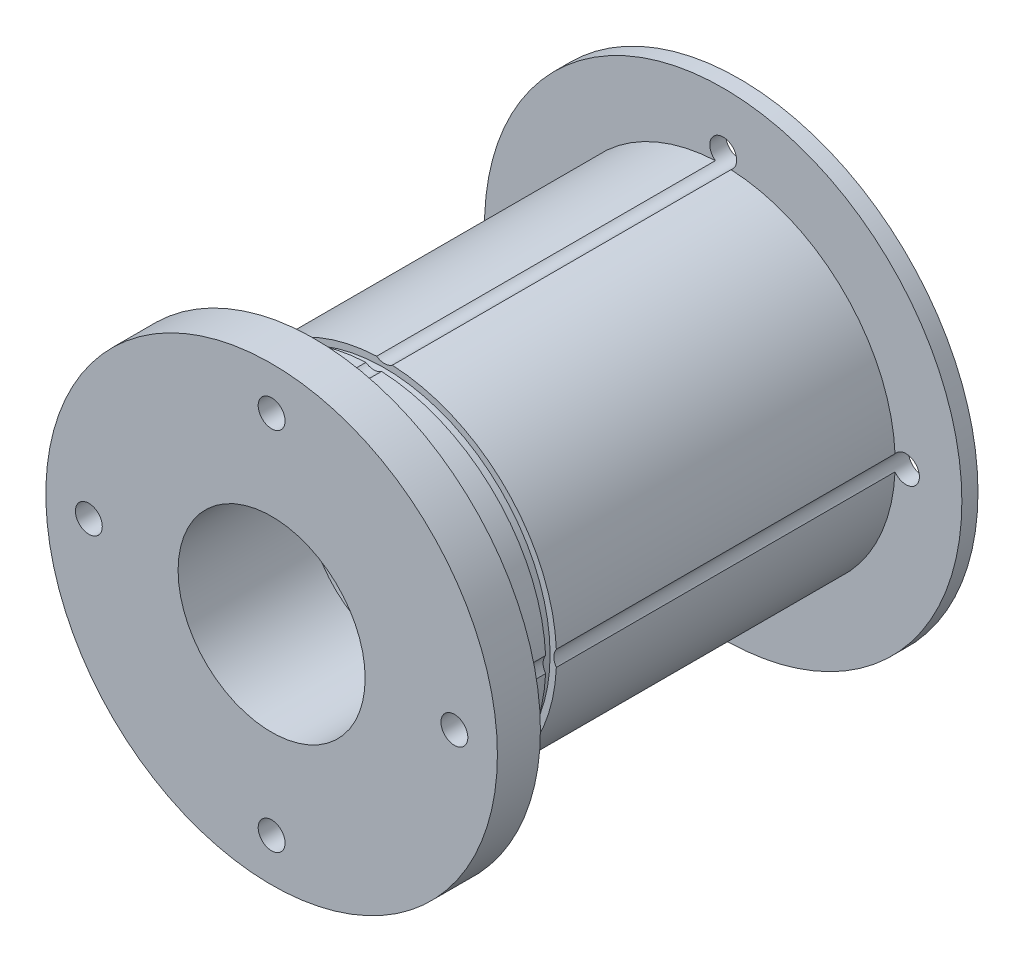
from build123d import *

# Parameters (mm, degrees)
HOLLOW_HUB_START               = -15
SKETCH_1_R                     = 16
SKETCH_1_R_2                   = 8.7
HOLLOW_HUB_DEPTH               = 38
REAR_STACK_FLANGE_START        = -16.5
SKETCH_2_R                     = 22.2
SKETCH_2_R_2                   = 13
REAR_STACK_FLANGE_DEPTH        = 1.5
SUN_MOUNT_FLANGE_START         = 23
SKETCH_3_R                     = 21
SKETCH_3_R_2                   = 8.7
SUN_MOUNT_FLANGE_DEPTH         = 4
REAR_ROTOR_BEARING_SEAT_START  = -15
SKETCH_4_R                     = 13
REAR_ROTOR_BEARING_SEAT_DEPTH  = 5
FRONT_ROTOR_BEARING_SEAT_START = 10
SKETCH_5_R                     = 13
FRONT_ROTOR_BEARING_SEAT_DEPTH = 5
CIRCLIP_GROOVE_START           = 16.5
SKETCH_6_R                     = 17
SKETCH_6_R_2                   = 15.4
CIRCLIP_GROOVE_DEPTH           = 1
SKETCH_7_R                     = 1.25
THROUGH_HOLES_DEPTH            = 100


with BuildPart() as part:
    # Эскиз1 → Hollow_hub (new body)
    with BuildSketch(Plane.XY.offset(HOLLOW_HUB_START)):
        Circle(SKETCH_1_R)
        Circle(SKETCH_1_R_2, mode=Mode.SUBTRACT)
    extrude(amount=HOLLOW_HUB_DEPTH)

    # Эскиз2 → Rear_stack_flange (add)
    with BuildSketch(Plane.XY.offset(REAR_STACK_FLANGE_START)):
        Circle(SKETCH_2_R)
        Circle(SKETCH_2_R_2, mode=Mode.SUBTRACT)
    extrude(amount=REAR_STACK_FLANGE_DEPTH)

    # Эскиз3 → Sun_mount_flange (add)
    with BuildSketch(Plane.XY.offset(SUN_MOUNT_FLANGE_START)):
        Circle(SKETCH_3_R)
        Circle(SKETCH_3_R_2, mode=Mode.SUBTRACT)
    extrude(amount=SUN_MOUNT_FLANGE_DEPTH)

    # Эскиз4 → Rear_rotor_bearing_seat (cut)
    with BuildSketch(Plane.XY.offset(REAR_ROTOR_BEARING_SEAT_START)):
        Circle(SKETCH_4_R)
    extrude(amount=REAR_ROTOR_BEARING_SEAT_DEPTH, mode=Mode.SUBTRACT)

    # Эскиз5 → Front_rotor_bearing_seat (cut)
    with BuildSketch(Plane.XY.offset(FRONT_ROTOR_BEARING_SEAT_START)):
        Circle(SKETCH_5_R)
    extrude(amount=FRONT_ROTOR_BEARING_SEAT_DEPTH, mode=Mode.SUBTRACT)

    # Эскиз6 → Circlip_groove (cut)
    with BuildSketch(Plane.XY.offset(CIRCLIP_GROOVE_START)):
        Circle(SKETCH_6_R)
        Circle(SKETCH_6_R_2, mode=Mode.SUBTRACT)
    extrude(amount=CIRCLIP_GROOVE_DEPTH, mode=Mode.SUBTRACT)

    # Эскиз7 → Through_holes (cut, symmetric)
    with BuildSketch(Plane.XY):
        with Locations((17, 0)):
            Circle(SKETCH_7_R)
        with Locations((0, 17)):
            Circle(SKETCH_7_R)
        with Locations((-17, 0)):
            Circle(SKETCH_7_R)
        with Locations((0, -17)):
            Circle(SKETCH_7_R)
    extrude(amount=THROUGH_HOLES_DEPTH, both=True, mode=Mode.SUBTRACT)


solid = part.part
